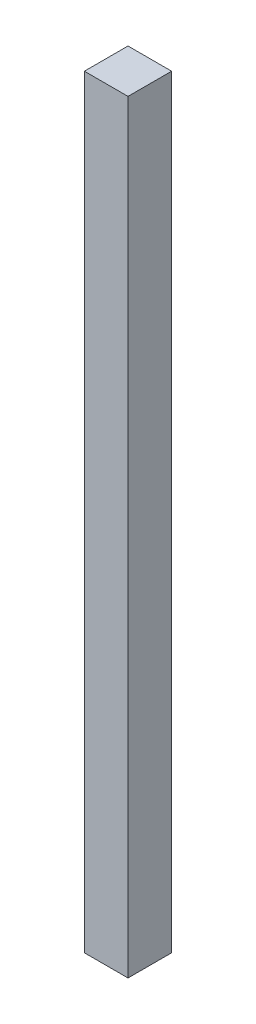
from build123d import *

# Parameters (mm, degrees)
SKETCH1_W           = 20
SKETCH1_H           = 20
BOSS_EXTRUDE1_DEPTH = 350


with BuildPart() as part:
    # Sketch1 → Boss-Extrude1 (new body)
    with BuildSketch(Plane(origin=(0, 0, 0), x_dir=(1, 0, 0), z_dir=(0, 1, 0))):
        with Locations((10, 10)):
            Rectangle(SKETCH1_W, SKETCH1_H)
    extrude(amount=BOSS_EXTRUDE1_DEPTH)


solid = part.part
